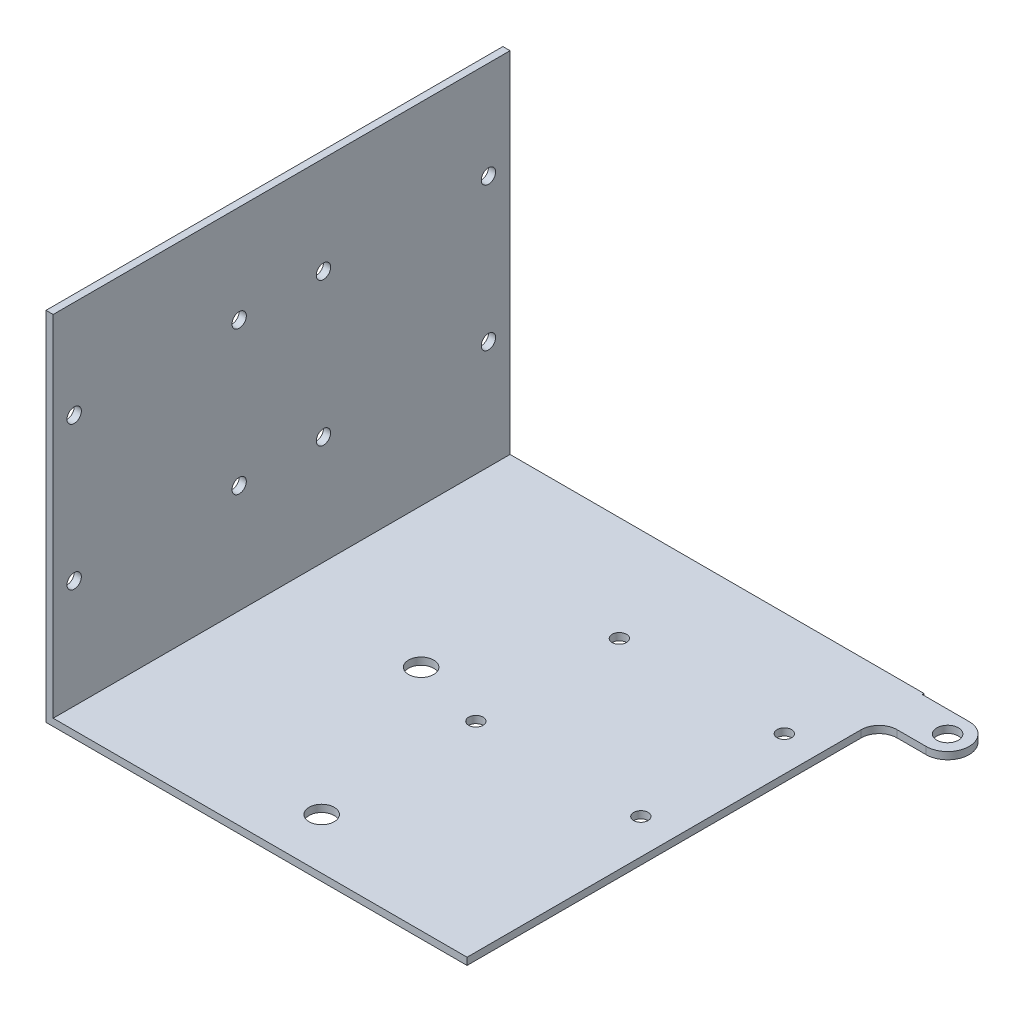
from build123d import *

# Parameters (mm, degrees)
SKETCH_1_W          = 127.39196645
SKETCH_1_H          = 99.499845157
SKETCH_1_R          = 2
EXTRUDE_1_DEPTH     = 2
SKETCH_2_W          = 127.39196645
SKETCH_2_H          = 2
EXTRUDE_2_DEPTH     = 115.4
SKETCH_4_R          = 2
CUT_EXTRUDE_1_DEPTH = 144.079097981
SKETCH_6_R          = 3.5
CUT_EXTRUDE_2_DEPTH = 166.366738145
SKETCH_7_R          = 3
EXTRUDE_3_DEPTH     = 2
FILLET_1_R          = 5


with BuildPart() as part:
    # Эскиз1 → Бобышка-Вытянуть1 (new body)
    with BuildSketch(Plane(origin=(0, 0, 0), x_dir=(0, 0, -1), z_dir=(1, 0, 0))):
        with Locations((0, 20.12589484)):
            Rectangle(SKETCH_1_W, SKETCH_1_H)
        with Locations((11.663084527, 42.625972261)):
            Circle(SKETCH_1_R, mode=Mode.SUBTRACT)
        with Locations((57.663084527, 42.625972261)):
            Circle(SKETCH_1_R, mode=Mode.SUBTRACT)
        with Locations((57.663084527, 2.625972261)):
            Circle(SKETCH_1_R, mode=Mode.SUBTRACT)
        with Locations((11.663084527, 2.625972261)):
            Circle(SKETCH_1_R, mode=Mode.SUBTRACT)
        with Locations(Location((-11.836915473, 2.625972261, 0), (0, 0, 180))):
            Circle(SKETCH_1_R, mode=Mode.SUBTRACT)
        with Locations(Location((-57.836915473, 2.625972261, 0), (0, 0, 180))):
            Circle(SKETCH_1_R, mode=Mode.SUBTRACT)
        with Locations(Location((-57.836915473, 42.625972261, 0), (0, 0, 180))):
            Circle(SKETCH_1_R, mode=Mode.SUBTRACT)
        with Locations(Location((-11.836915473, 42.625972261, 0), (0, 0, 180))):
            Circle(SKETCH_1_R, mode=Mode.SUBTRACT)
    extrude(amount=EXTRUDE_1_DEPTH)

    # Эскиз2 → Бобышка-Вытянуть2 (add)
    with BuildSketch(Plane(origin=(2, 0, 0), x_dir=(0, 0, -1), z_dir=(1, 0, 0))):
        with Locations((0, -28.624027739)):
            Rectangle(SKETCH_2_W, SKETCH_2_H)
    extrude(amount=EXTRUDE_2_DEPTH)

    # Эскиз4 → Вырез-Вытянуть1 (cut, through all)
    with BuildSketch(Plane(origin=(0, 21.675972261, 0), x_dir=(1, 0, 0), z_dir=(0, 1, 0))):
        with Locations(Location((61.65, 34.512555998, 0), (0, 0, 270))):
            Circle(SKETCH_4_R)
        with Locations(Location((61.65, -5.487444002, 0), (0, 0, 270))):
            Circle(SKETCH_4_R)
        with Locations(Location((107.65, -5.487444002, 0), (0, 0, 270))):
            Circle(SKETCH_4_R)
        with Locations(Location((107.65, 34.512555998, 0), (0, 0, 270))):
            Circle(SKETCH_4_R)
    extrude(amount=-CUT_EXTRUDE_1_DEPTH, mode=Mode.SUBTRACT)

    # Эскиз6 → Вырез-Вытянуть2 (cut, through all)
    with BuildSketch(Plane(origin=(0, -27.624027739, 0), x_dir=(1, 0, 0), z_dir=(0, 1, 0))):
        with Locations(Location((62.669967975, -49.504016775, 0), (0, 0, 270))):
            Circle(SKETCH_6_R)
        with Locations(Location((40.99052879, -0.086168012, 0), (0, 0, 270))):
            Circle(SKETCH_6_R)
    extrude(amount=-CUT_EXTRUDE_2_DEPTH, mode=Mode.SUBTRACT)

    # Эскиз7 → Бобышка-Вытянуть3 (add)
    with BuildSketch(Plane(origin=(0, -27.624027739, 0), x_dir=(1, 0, 0), z_dir=(0, 1, 0))):
        with BuildLine():
            Line((130.5, 51.195983225), (117.4, 51.195983225))
            Line((117.4, 51.195983225), (117.4, 63.195983225))
            Line((117.4, 63.195983225), (130.5, 63.195983225))
            ThreePointArc((130.5, 63.195983225), (136.5, 57.195983225), (130.5, 51.195983225))
        make_face()
        with Locations(Location((130.5, 57.195983225, 0), (0, 0, 270))):
            Circle(SKETCH_7_R, mode=Mode.SUBTRACT)
    extrude(amount=-EXTRUDE_3_DEPTH)

    # Скругление1
    fillet_1_edges = [part.edges().sort_by_distance(p)[0] for p in [
        (117.4, -28.624027739, -51.195983225),
    ]]
    fillet(fillet_1_edges, radius=FILLET_1_R)


solid = part.part
